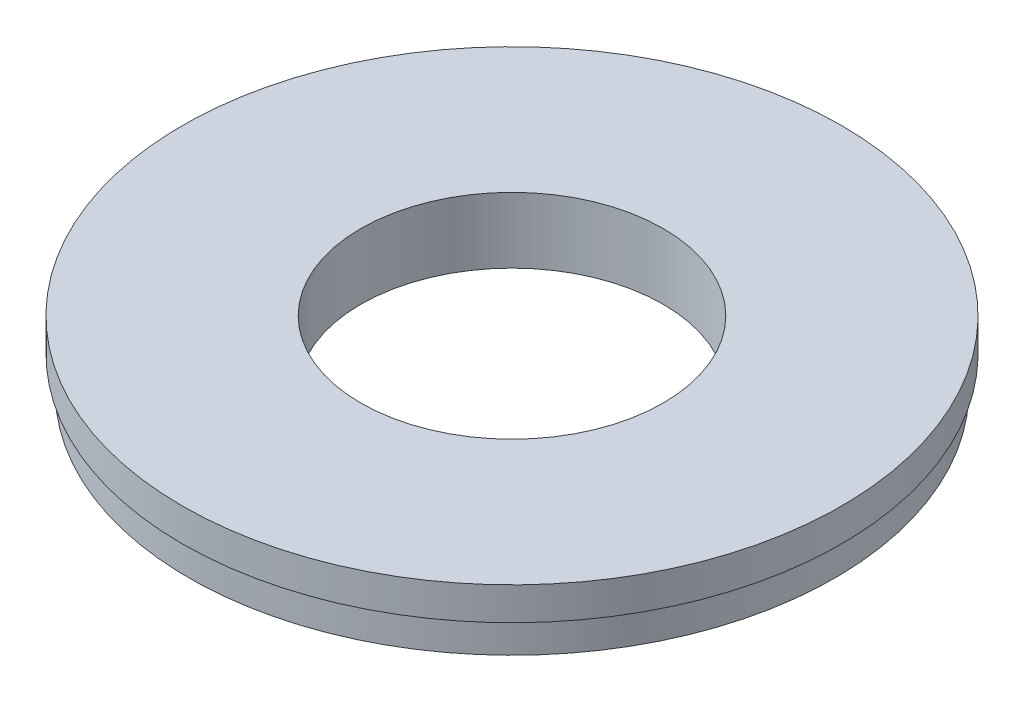
from build123d import *


with BuildPart() as part:
    # Sketch1 → Revolve1 (revolve)
    with BuildSketch(Plane.XY, mode=Mode.PRIVATE) as revolve1_sk:
        Polygon((27.5, 11.938), (59.944, 11.938), (59.944, 5.969), (58.7502, 5.969), (58.7502, 0), (27.5, 0), align=None)
    revolve(revolve1_sk.sketch.rotate(Axis((0, 0, 0), (0, 1, 0)), 90), axis=Axis((0, 0, 0), (0, 1, 0)))


solid = part.part
